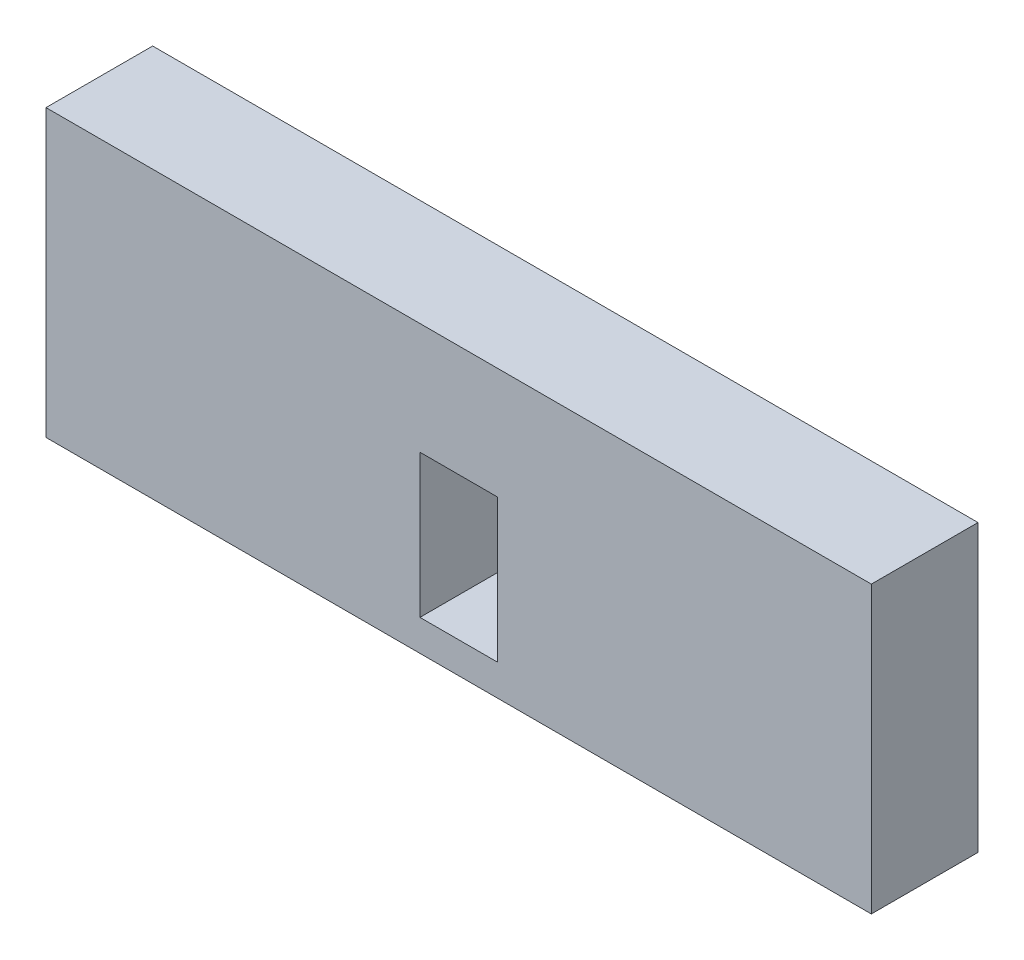
from build123d import *

# Parameters (mm, degrees)
ESBO_O1_W                = 130
ESBO_O1_H                = 45
RESSALTO_EXTRUS_O1_DEPTH = 16.8
ESBO_O2_W                = 12.2
ESBO_O2_H                = 22.53
CORTE_EXTRUS_O1_DEPTH    = 139.590187243


with BuildPart() as part:
    # Esboço1 → Ressalto-extrusão1 (new body)
    with BuildSketch(Plane.XY):
        with Locations((65, 22.5)):
            Rectangle(ESBO_O1_W, ESBO_O1_H)
    extrude(amount=RESSALTO_EXTRUS_O1_DEPTH)

    # Esboço2 → Corte-extrusão1 (cut, through all)
    with BuildSketch(Plane.XY.offset(16.8)):
        with Locations((65, 16.175)):
            Rectangle(ESBO_O2_W, ESBO_O2_H)
    extrude(amount=-CORTE_EXTRUS_O1_DEPTH, mode=Mode.SUBTRACT)


solid = part.part
